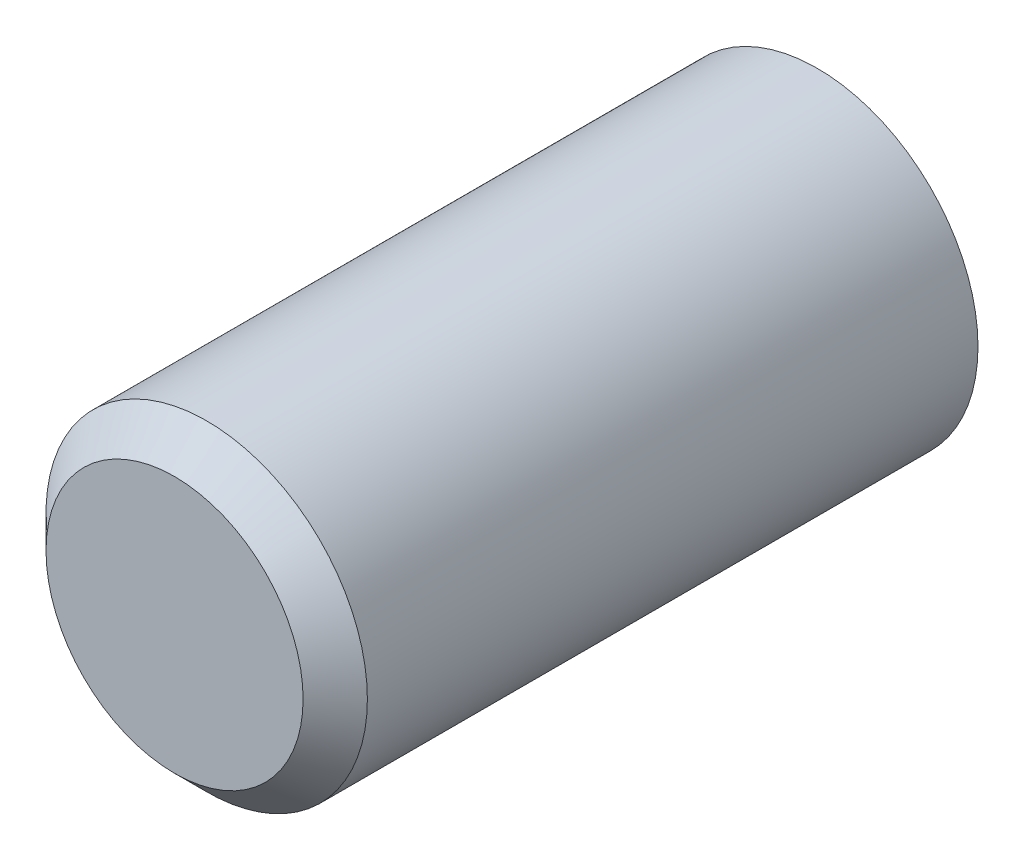
from build123d import *

# Parameters (mm, degrees)
SKETCH_1_R      = 25
EXTRUDE_1_DEPTH = 100
CHAMFER_1_SIZE  = 5


with BuildPart() as part:
    # Эскиз1 → Бобышка-Вытянуть1 (new body)
    with BuildSketch(Plane.XY):
        Circle(SKETCH_1_R)
    extrude(amount=EXTRUDE_1_DEPTH)

    # Фаска1
    chamfer_1_edges = [part.edges().sort_by_distance(p)[0] for p in [
        (-25, 0, 100),
    ]]
    chamfer(chamfer_1_edges, length=CHAMFER_1_SIZE)


solid = part.part
